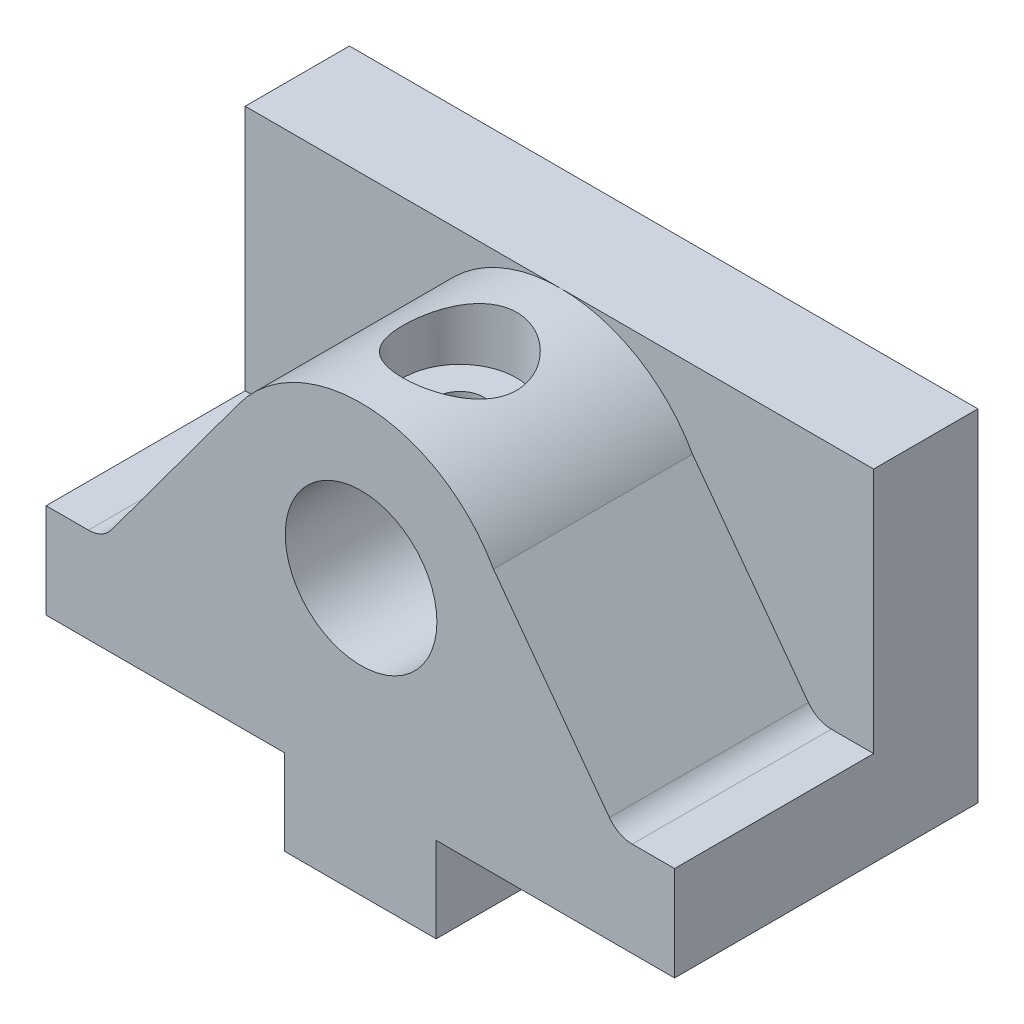
from build123d import *

# Parameters (mm, degrees)
SKETCH1_R              = 8
BOSS_EXTRUDE1_DEPTH    = 21
SKETCH2_W              = 66.3
SKETCH2_H              = 36
BOSS_EXTRUDE2_DEPTH    = 11
SKETCH19_R             = 6
CUT_EXTRUDE7_DEPTH     = 6
M6_TAPPED_HOLE1_REACH  = 57.517
M6_TAPPED_HOLE1_BORE_R = 2.5


with BuildPart() as part:
    # Sketch1 → Boss-Extrude1 (new body)
    with BuildSketch(Plane.XY):
        with BuildLine():
            Line((-33.15, -16), (-8, -16))
            Line((-8, -16), (-8, -25))
            Line((-8, -25), (8, -25))
            Line((8, -25), (8, -16))
            Line((8, -16), (33.15, -16))
            Line((33.15, -16), (33.15, -6))
            Line((33.15, -6), (28.687572119, -6))
            ThreePointArc((28.687572119, -6), (27.334939497, -5.677757455), (26.272890727, -4.78025666))
            Line((26.272890727, -4.78025666), (14.048740351, 11.800177564))
            ThreePointArc((14.048740351, 11.800177564), (1.086707772, 19.968226779), (-12.799429053, 13.494702186))
            Line((-12.799429053, 13.494702186), (-26.272890727, -4.78025666))
            ThreePointArc((-26.272890727, -4.78025666), (-27.334939497, -5.677757455), (-28.687572119, -6))
            Line((-28.687572119, -6), (-33.15, -6))
            Line((-33.15, -6), (-33.15, -16))
        make_face()
        with Locations(Location((0.078871705, 4, 0), (0, 0, 180))):
            Circle(SKETCH1_R, mode=Mode.SUBTRACT)
    extrude(amount=BOSS_EXTRUDE1_DEPTH)

    # Sketch2 → Boss-Extrude2 (add)
    with BuildSketch(Plane(origin=(0, 0, 0), x_dir=(-1, 0, 0), z_dir=(0, 0, -1))):
        with Locations((0, 2)):
            Rectangle(SKETCH2_W, SKETCH2_H)
    extrude(amount=BOSS_EXTRUDE2_DEPTH)

    # Sketch19 → Cut-Extrude7 (cut)
    with BuildSketch(Plane(origin=(0, 20, 0), x_dir=(1, 0, 0), z_dir=(0, 1, 0))):
        with Locations(Location((0, -10.5, 0), (0, 0, 270))):
            Circle(SKETCH19_R)
    extrude(amount=-CUT_EXTRUDE7_DEPTH, mode=Mode.SUBTRACT)

    # M6 Tapped Hole1 bore (on position points) → M6 Tapped Hole1 (cut, up to next)
    with BuildSketch(Plane(origin=(0, 14, 10.5), x_dir=(0, 0, 1), z_dir=(0, 1, 0)), mode=Mode.PRIVATE) as m6_tapped_hole1_sk1:
        Circle(M6_TAPPED_HOLE1_BORE_R)
    m6_tapped_hole1_tool1 = extrude(m6_tapped_hole1_sk1.sketch, amount=-M6_TAPPED_HOLE1_REACH, mode=Mode.PRIVATE) & part.part
    add(m6_tapped_hole1_tool1.solids().sort_by_distance((0, 14, 10.5))[0], mode=Mode.SUBTRACT)


solid = part.part
